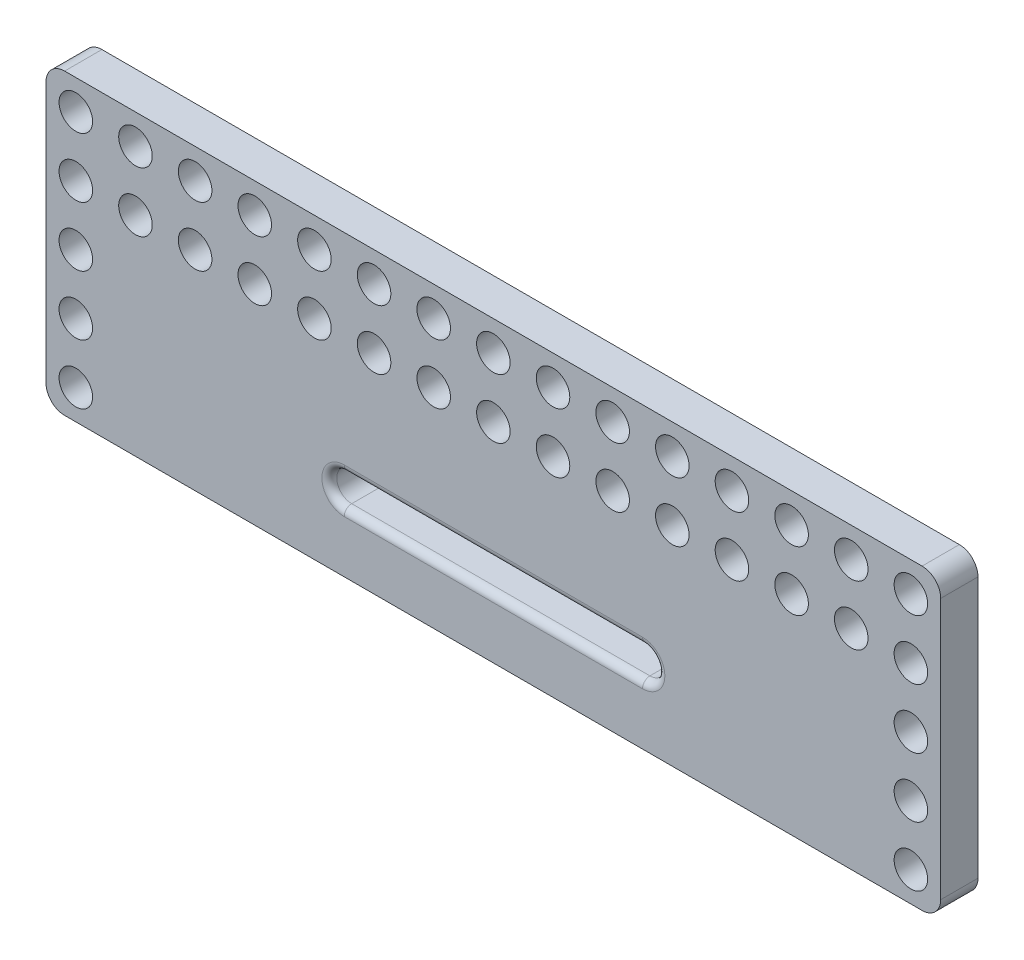
from build123d import *

# Parameters (mm, degrees)
SKETCH_1_W      = 120
SKETCH_1_H      = 40
SKETCH_1_R      = 2.25
EXTRUDE_1_DEPTH = 5
FILLET_1_R      = 2.5
FILLET_2_R      = 1


with BuildPart() as part:
    # 草图1 → 凸台-拉伸1 (new body)
    with BuildSketch(Plane.XY):
        Rectangle(SKETCH_1_W, SKETCH_1_H)
        with Locations((-56, -16)):
            Circle(SKETCH_1_R, mode=Mode.SUBTRACT)
        with Locations((-56, -8)):
            Circle(SKETCH_1_R, mode=Mode.SUBTRACT)
        with Locations((-56, 0)):
            Circle(SKETCH_1_R, mode=Mode.SUBTRACT)
        with Locations((-56, 8)):
            Circle(SKETCH_1_R, mode=Mode.SUBTRACT)
        with Locations((-56, 16)):
            Circle(SKETCH_1_R, mode=Mode.SUBTRACT)
        with Locations((56, 16)):
            Circle(SKETCH_1_R, mode=Mode.SUBTRACT)
        with Locations((56, 8)):
            Circle(SKETCH_1_R, mode=Mode.SUBTRACT)
        with Locations((56, 0)):
            Circle(SKETCH_1_R, mode=Mode.SUBTRACT)
        with Locations((56, -16)):
            Circle(SKETCH_1_R, mode=Mode.SUBTRACT)
        with Locations((56, -8)):
            Circle(SKETCH_1_R, mode=Mode.SUBTRACT)
        with Locations((-48, 16)):
            Circle(SKETCH_1_R, mode=Mode.SUBTRACT)
        with Locations((-48, 8)):
            Circle(SKETCH_1_R, mode=Mode.SUBTRACT)
        with Locations((-40, 16)):
            Circle(SKETCH_1_R, mode=Mode.SUBTRACT)
        with Locations((-40, 8)):
            Circle(SKETCH_1_R, mode=Mode.SUBTRACT)
        with Locations((-32, 16)):
            Circle(SKETCH_1_R, mode=Mode.SUBTRACT)
        with Locations((-32, 8)):
            Circle(SKETCH_1_R, mode=Mode.SUBTRACT)
        with Locations((-24, 16)):
            Circle(SKETCH_1_R, mode=Mode.SUBTRACT)
        with Locations((-24, 8)):
            Circle(SKETCH_1_R, mode=Mode.SUBTRACT)
        with Locations((-16, 16)):
            Circle(SKETCH_1_R, mode=Mode.SUBTRACT)
        with Locations((-16, 8)):
            Circle(SKETCH_1_R, mode=Mode.SUBTRACT)
        with Locations((-8, 16)):
            Circle(SKETCH_1_R, mode=Mode.SUBTRACT)
        with Locations((-8, 8)):
            Circle(SKETCH_1_R, mode=Mode.SUBTRACT)
        with Locations((0, 16)):
            Circle(SKETCH_1_R, mode=Mode.SUBTRACT)
        with Locations((0, 8)):
            Circle(SKETCH_1_R, mode=Mode.SUBTRACT)
        with Locations((8, 16)):
            Circle(SKETCH_1_R, mode=Mode.SUBTRACT)
        with Locations((8, 8)):
            Circle(SKETCH_1_R, mode=Mode.SUBTRACT)
        with Locations((16, 16)):
            Circle(SKETCH_1_R, mode=Mode.SUBTRACT)
        with Locations((16, 8)):
            Circle(SKETCH_1_R, mode=Mode.SUBTRACT)
        with Locations((24, 16)):
            Circle(SKETCH_1_R, mode=Mode.SUBTRACT)
        with Locations((24, 8)):
            Circle(SKETCH_1_R, mode=Mode.SUBTRACT)
        with Locations((32, 16)):
            Circle(SKETCH_1_R, mode=Mode.SUBTRACT)
        with Locations((32, 8)):
            Circle(SKETCH_1_R, mode=Mode.SUBTRACT)
        with Locations((40, 16)):
            Circle(SKETCH_1_R, mode=Mode.SUBTRACT)
        with Locations((40, 8)):
            Circle(SKETCH_1_R, mode=Mode.SUBTRACT)
        with Locations((48, 16)):
            Circle(SKETCH_1_R, mode=Mode.SUBTRACT)
        with Locations((48, 8)):
            Circle(SKETCH_1_R, mode=Mode.SUBTRACT)
        with BuildLine():
            Line((20, -8), (-20, -8))
            ThreePointArc((-20, -8), (-22, -10), (-20, -12))
            Line((-20, -12), (20, -12))
            ThreePointArc((20, -12), (22, -10), (20, -8))
        make_face(mode=Mode.SUBTRACT)
    extrude(amount=EXTRUDE_1_DEPTH)

    # 圆角1
    fillet_1_edges = [part.edges().sort_by_distance(p)[0] for p in [
        (60, -20, 2.5),
        (-60, -20, 2.5),
        (-60, 20, 2.5),
        (60, 20, 2.5),
    ]]
    fillet(fillet_1_edges, radius=FILLET_1_R)

    # 圆角2
    fillet_2_edges = [part.edges().sort_by_distance(p)[0] for p in [
        (0, -8, 5),
        (22, -10, 5),
        (0, -12, 5),
        (-22, -10, 5),
    ]]
    fillet(fillet_2_edges, radius=FILLET_2_R)


solid = part.part
